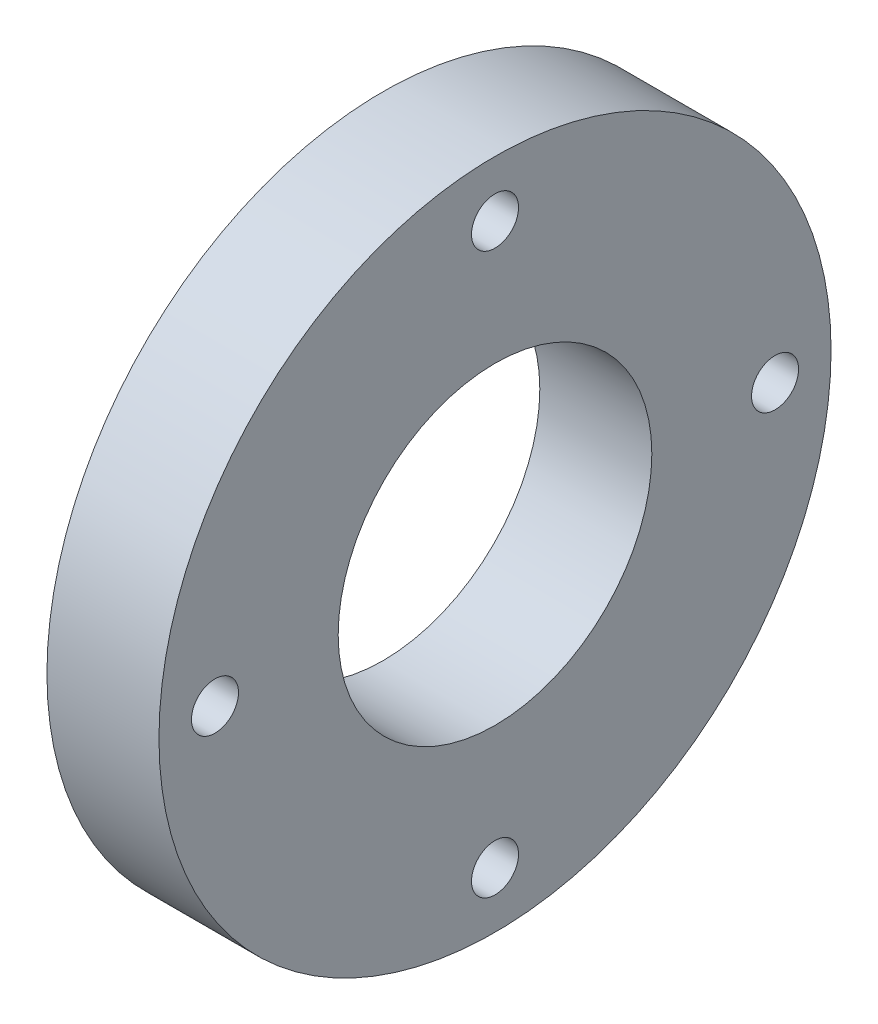
from build123d import *

# Parameters (mm, degrees)
SKETCH1_W                      = 5
SKETCH1_H                      = 15
F_14_0_14_DIAMETER_HOLE1_D     = 14
F_2_1_2_1_DIAMETER_HOLE1_D     = 2.1
F_2_1_2_1_DIAMETER_HOLE1_DEPTH = 2.5


with BuildPart() as part:
    # Sketch1 → Revolve1 (revolve)
    with BuildSketch(Plane.XY, mode=Mode.PRIVATE) as revolve1_sk:
        with Locations((23.5, 7.5)):
            Rectangle(SKETCH1_W, SKETCH1_H)
    revolve(revolve1_sk.sketch.rotate(Axis((21, 0, 0), (1, 0, 0)), 270), axis=Axis((21, 0, 0), (1, 0, 0)))

    # Ø14.0 (14) Diameter Hole1 (through all)
    with Locations(Plane.ZY.offset(-21)):
        with Locations((0, 0)):
            Hole(F_14_0_14_DIAMETER_HOLE1_D / 2)

    # Ø2.1 (2.1) Diameter Hole1
    with Locations(Plane(origin=(26, 0, 0), x_dir=(0, 0, -1), z_dir=(1, 0, 0))):
        with Locations((-12.5, 0), (12.5, 0), (0, -12.5), (0, 12.5)):
            Hole(F_2_1_2_1_DIAMETER_HOLE1_D / 2, depth=F_2_1_2_1_DIAMETER_HOLE1_DEPTH)


solid = part.part
